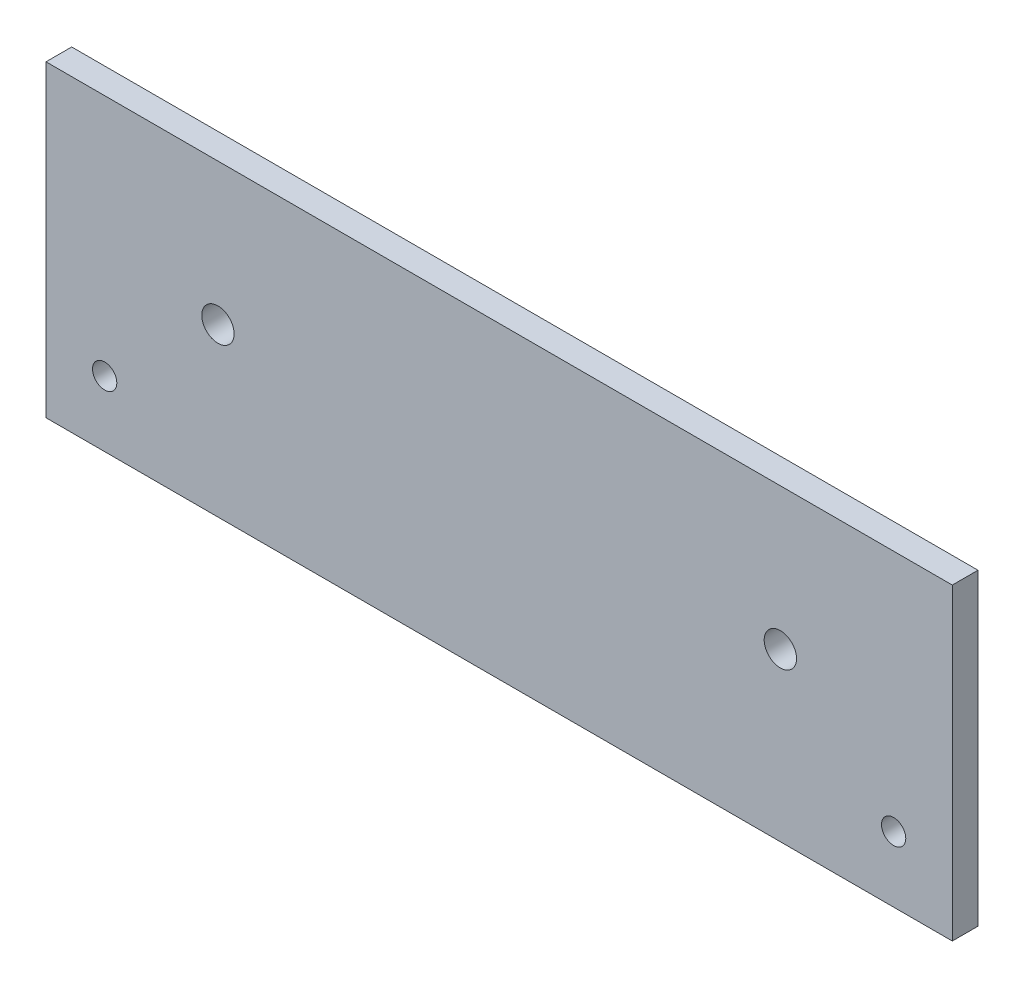
from build123d import *

# Parameters (mm, degrees)
SKETCH1_W           = 224
SKETCH1_H           = 76.2
SKETCH1_R           = 4
SKETCH1_R_2         = 3
BOSS_EXTRUDE1_DEPTH = 6.35


with BuildPart() as part:
    # Sketch1 → Boss-Extrude1 (new body)
    with BuildSketch(Plane.XY):
        with Locations((112, 38.1)):
            Rectangle(SKETCH1_W, SKETCH1_H)
        with Locations((42.5, 41.2)):
            Circle(SKETCH1_R, mode=Mode.SUBTRACT)
        with Locations((181.5, 41.2)):
            Circle(SKETCH1_R, mode=Mode.SUBTRACT)
        with Locations((14.5, 16.2)):
            Circle(SKETCH1_R_2, mode=Mode.SUBTRACT)
        with Locations((209.5, 16.2)):
            Circle(SKETCH1_R_2, mode=Mode.SUBTRACT)
    extrude(amount=BOSS_EXTRUDE1_DEPTH)


solid = part.part
